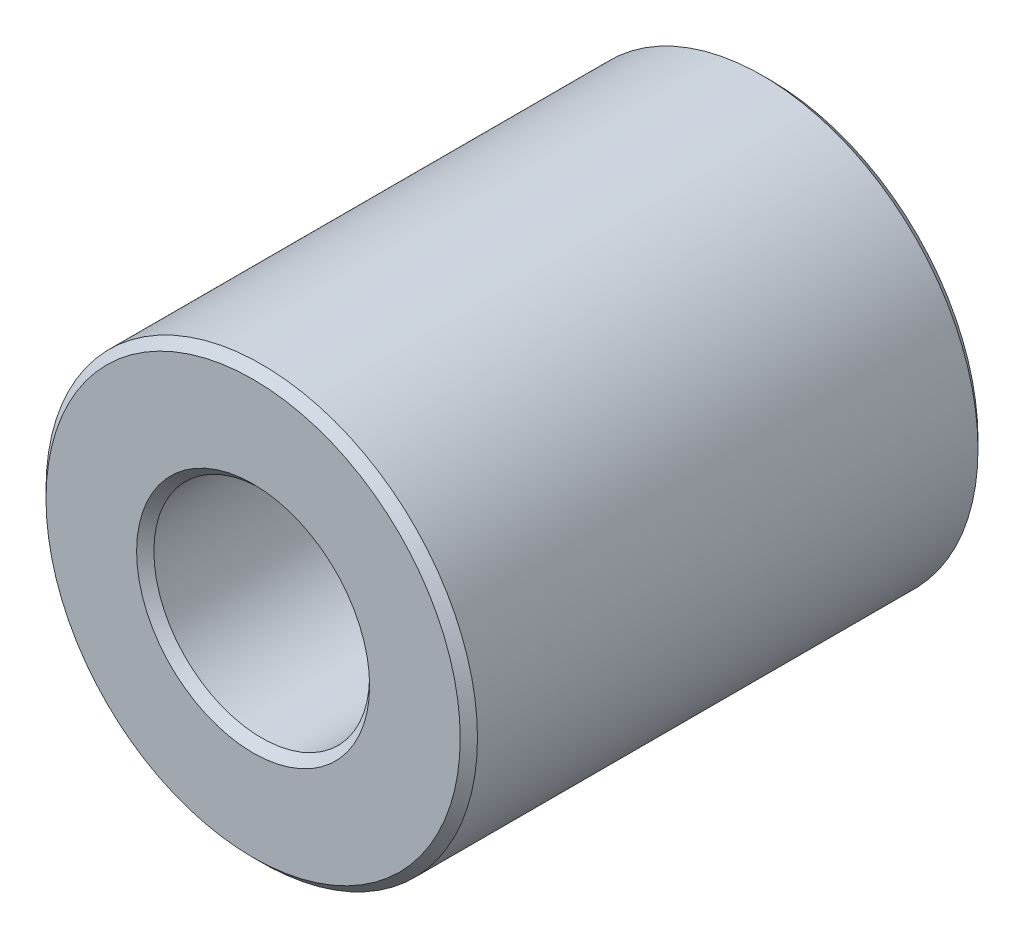
from build123d import *

# Parameters (mm, degrees)
CROQUIS1_R              = 25
CROQUIS1_R_2            = 12.5
SALIENTE_EXTRUIR1_DEPTH = 60
CHAFL_N1_SIZE           = 1


with BuildPart() as part:
    # Croquis1 → Saliente-Extruir1 (new body)
    with BuildSketch(Plane.XY):
        Circle(CROQUIS1_R)
        Circle(CROQUIS1_R_2, mode=Mode.SUBTRACT)
    extrude(amount=SALIENTE_EXTRUIR1_DEPTH)

    # Chaflán1
    chafl_n1_edges = [part.edges().sort_by_distance(p)[0] for p in [
        (-25, 0, 0),
        (-25, 0, 60),
        (-12.5, 0, 0),
        (-12.5, 0, 60),
    ]]
    chamfer(chafl_n1_edges, length=CHAFL_N1_SIZE)


solid = part.part
